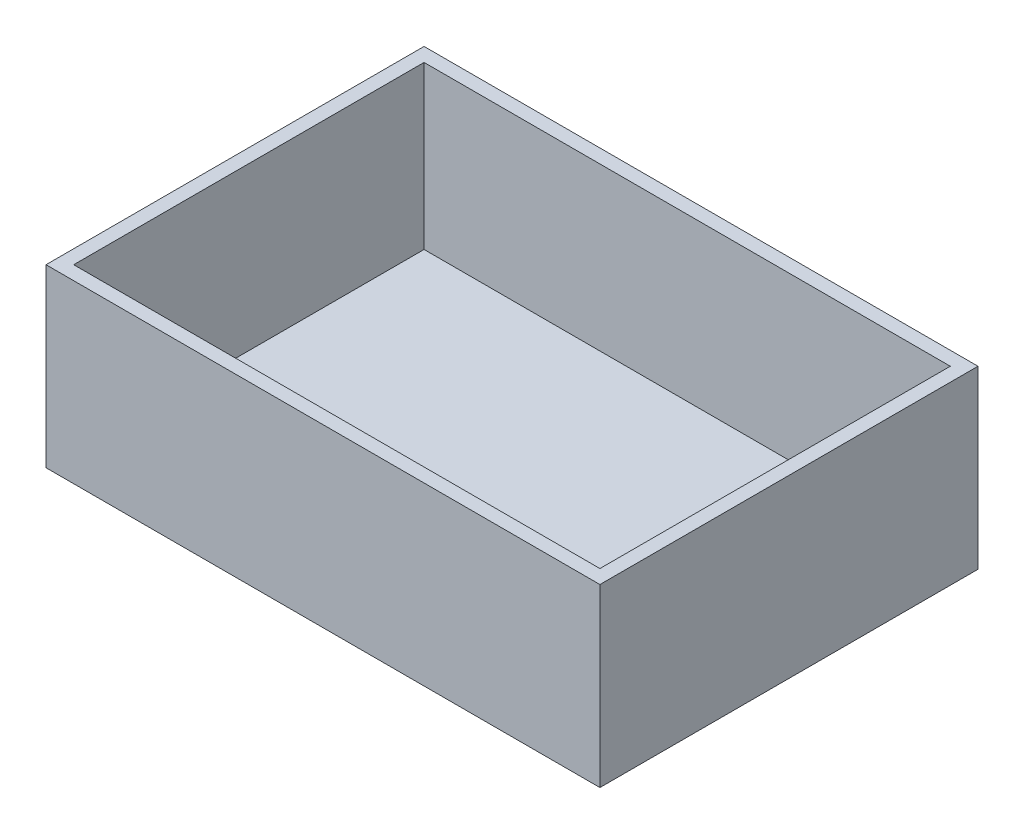
from build123d import *

# Parameters (mm, degrees)
ESBO_O2_W                = 50.4
ESBO_O2_H                = 34.4
RESSALTO_EXTRUS_O1_DEPTH = 16
CASCA1_T                 = -1.26


with BuildPart() as part:
    # Esboço2 → Ressalto-extrusão1 (new body)
    with BuildSketch(Plane(origin=(0, 0, 0), x_dir=(1, 0, 0), z_dir=(0, 1, 0))):
        with Locations((25.2, -17.2)):
            Rectangle(ESBO_O2_W, ESBO_O2_H)
    extrude(amount=RESSALTO_EXTRUS_O1_DEPTH)

    # Casca1
    casca1_openings = [part.faces().sort_by_distance(p)[0] for p in [
        (25.2, 16, 17.2),
    ]]
    offset(amount=CASCA1_T, openings=casca1_openings, kind=Kind.INTERSECTION)


solid = part.part
